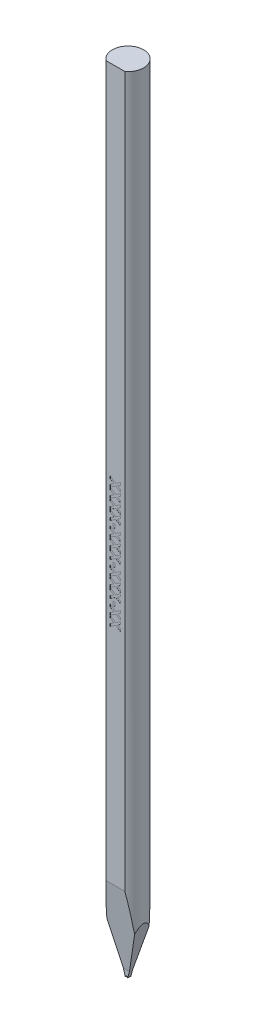
from build123d import *

# Parameters (mm, degrees)
SKETCH_TL_CUTTING_R       = 1.4986
TL_CUTTING_DEPTH          = 75.9968
SKETCH_TDF_GRINDING_W     = 3.0172
SKETCH_TDF_GRINDING_H     = 3.0172
TDF_GRINDING_DEPTH        = 77.026345527
SKETCH_ENGRAVING_W        = 0.166666667
SKETCH_ENGRAVING_H        = 0.371794872
ENGRAVING_DEPTH           = 0.005
VW_VR_GRINDING_DEPTH      = 1.5086
VW_VR_GRINDING_DEPTH_BACK = 1.5086
ISA_GRINDING_DEPTH        = 1.5086
ISA_GRINDING_DEPTH_BACK   = 1.5086
PRE_FRX_BRX_DEPTH         = 1.5086
PRE_FRX_BRX_DEPTH_BACK    = 1.5086
SKETCH_PRE_FRX_BRX_W      = 1.35874
SKETCH_PRE_FRX_BRX_H      = 0.6096
FR_EDM_R                  = 0.0381
BR_EDM_R                  = 0.0381
FA_BA_GRINDING_DEPTH      = 1.5086
FA_BA_GRINDING_DEPTH_BACK = 1.5086


with BuildPart() as part:
    # sketch_TL_cutting → TL_cutting (new body)
    with BuildSketch(Plane(origin=(0, 0, 0), x_dir=(1, 0, 0), z_dir=(0, 1, 0))):
        with Locations(Location((0, 0, 0), (0, 0, 270))):
            Circle(SKETCH_TL_CUTTING_R)
    extrude(amount=TL_CUTTING_DEPTH)

    # sketch_TDF_grinding → TDF_grinding (cut, through all)
    with BuildSketch(Plane(origin=(0, 0, 0), x_dir=(1, 0, 0), z_dir=(0, 1, 0))):
        with Locations((0, -2.71002)):
            Rectangle(SKETCH_TDF_GRINDING_W, SKETCH_TDF_GRINDING_H)
    extrude(amount=TDF_GRINDING_DEPTH, mode=Mode.SUBTRACT)

    # sketch_engraving → engraving (cut)
    with BuildSketch(Plane.XY.offset(1.20142)):
        Polygon((-0.5, 41.791829744), (0.029647436, 41.449081346), (0.5, 41.753368205), (0.5, 41.52860859), (0.203325321, 41.336701538), (0.5, 41.144794487), (0.5, 40.920034872), (0.029647436, 41.224321731), (-0.5, 40.881573333), (-0.5, 41.106332949), (-0.144030449, 41.336701538), (-0.5, 41.567070128), align=None)
        Polygon((-0.5, 40.868752821), (0.029647436, 40.526004423), (0.5, 40.830291282), (0.5, 40.605531667), (0.203325321, 40.413624615), (0.5, 40.221717564), (0.5, 39.996957949), (0.029647436, 40.301244808), (-0.5, 39.95849641), (-0.5, 40.183256026), (-0.144030449, 40.413624615), (-0.5, 40.643993205), align=None)
        Polygon((-0.5, 39.945675897), (0.029647436, 39.6029275), (0.5, 39.907214359), (0.5, 39.682454744), (0.203325321, 39.490547692), (0.5, 39.298640641), (0.5, 39.073881026), (0.029647436, 39.378167885), (-0.5, 39.035419487), (-0.5, 39.260179103), (-0.144030449, 39.490547692), (-0.5, 39.720916282), align=None)
        Polygon((-0.5, 39.022598974), (0.029647436, 38.679850577), (0.5, 38.984137436), (0.5, 38.759377821), (0.203325321, 38.567470769), (0.5, 38.375563718), (0.5, 38.150804103), (0.029647436, 38.455090962), (-0.5, 38.112342564), (-0.5, 38.337102179), (-0.144030449, 38.567470769), (-0.5, 38.797839359), align=None)
        with Locations((-0.147435898, 37.843111795)):
            Rectangle(SKETCH_ENGRAVING_W, SKETCH_ENGRAVING_H)
        Polygon((-0.5, 37.63798359), (0.029647436, 37.295235192), (0.5, 37.599522051), (0.5, 37.374762436), (0.203325321, 37.182855385), (0.5, 36.990948333), (0.5, 36.766188718), (0.029647436, 37.070475577), (-0.5, 36.727727179), (-0.5, 36.952486795), (-0.144030449, 37.182855385), (-0.5, 37.413223974), align=None)
        Polygon((-0.5, 36.714906667), (0.029647436, 36.372158269), (0.5, 36.676445128), (0.5, 36.451685513), (0.203325321, 36.259778462), (0.5, 36.06787141), (0.5, 35.843111795), (0.029647436, 36.147398654), (-0.5, 35.804650256), (-0.5, 36.029409872), (-0.144030449, 36.259778462), (-0.5, 36.490147051), align=None)
        Polygon((-0.5, 35.791829744), (0.029647436, 35.449081346), (0.5, 35.753368205), (0.5, 35.52860859), (0.203325321, 35.336701538), (0.5, 35.144794487), (0.5, 34.920034872), (0.029647436, 35.224321731), (-0.5, 34.881573333), (-0.5, 35.106332949), (-0.144030449, 35.336701538), (-0.5, 35.567070128), align=None)
        with Locations((-0.147435898, 34.612342564)):
            Rectangle(SKETCH_ENGRAVING_W, SKETCH_ENGRAVING_H)
        Polygon((-0.5, 34.407214359), (0.029647436, 34.064465962), (0.5, 34.368752821), (0.5, 34.143993205), (0.203325321, 33.952086154), (0.5, 33.760179103), (0.5, 33.535419487), (0.029647436, 33.839706346), (-0.5, 33.496957949), (-0.5, 33.721717564), (-0.144030449, 33.952086154), (-0.5, 34.182454744), align=None)
        Polygon((-0.5, 33.484137436), (0.029647436, 33.141389038), (0.5, 33.445675897), (0.5, 33.220916282), (0.203325321, 33.029009231), (0.5, 32.837102179), (0.5, 32.612342564), (0.029647436, 32.916629423), (-0.5, 32.573881026), (-0.5, 32.798640641), (-0.144030449, 33.029009231), (-0.5, 33.259377821), align=None)
        Polygon((-0.5, 32.561060513), (0.029647436, 32.218312115), (0.5, 32.522598974), (0.5, 32.297839359), (0.203325321, 32.105932308), (0.5, 31.914025256), (0.5, 31.689265641), (0.029647436, 31.9935525), (-0.5, 31.650804103), (-0.5, 31.875563718), (-0.144030449, 32.105932308), (-0.5, 32.336300897), align=None)
        with Locations((-0.147435898, 31.381573333)):
            Rectangle(SKETCH_ENGRAVING_W, SKETCH_ENGRAVING_H)
        Polygon((-0.5, 31.176445128), (0.029647436, 30.833696731), (0.5, 31.13798359), (0.5, 30.913223974), (0.203325321, 30.721316923), (0.5, 30.529409872), (0.5, 30.304650256), (0.029647436, 30.608937115), (-0.5, 30.266188718), (-0.5, 30.490948333), (-0.144030449, 30.721316923), (-0.5, 30.951685513), align=None)
        Polygon((-0.5, 30.253368205), (0.029647436, 29.910619808), (0.5, 30.214906667), (0.5, 29.990147051), (0.203325321, 29.79824), (0.5, 29.606332949), (0.5, 29.381573333), (0.029647436, 29.685860192), (-0.5, 29.343111795), (-0.5, 29.56787141), (-0.144030449, 29.79824), (-0.5, 30.02860859), align=None)
    extrude(amount=-ENGRAVING_DEPTH, mode=Mode.SUBTRACT)

    # sketch_VW_VR_grinding → VW_VR_grinding (cut, two sides: drawn at the far end of the back side and taken through both)
    with BuildSketch(Plane.XY.offset(-VW_VR_GRINDING_DEPTH_BACK)):
        with BuildLine():
            Line((-1.4936, -0.01), (-1.4936, 0.5946))
            ThreePointArc((-1.4936, 0.5946), (-1.495064466, 0.598135534), (-1.4986, 0.5996))
            Line((-1.4986, 0.5996), (-1.5086, 0.5996))
            Line((-1.5086, 0.5996), (-1.5086, -0.01))
            Line((-1.5086, -0.01), (-1.4936, -0.01))
        make_face()
        with BuildLine():
            Line((1.4936, -0.01), (1.4936, 0.5946))
            ThreePointArc((1.4936, 0.5946), (1.495064466, 0.598135534), (1.4986, 0.5996))
            Line((1.4986, 0.5996), (1.5086, 0.5996))
            Line((1.5086, 0.5996), (1.5086, -0.01))
            Line((1.5086, -0.01), (1.4936, -0.01))
        make_face()
    extrude(amount=VW_VR_GRINDING_DEPTH + VW_VR_GRINDING_DEPTH_BACK, mode=Mode.SUBTRACT)

    # sketch_ISA_grinding → ISA_grinding (cut, two sides: drawn at the far end of the back side and taken through both)
    with BuildSketch(Plane.XY.offset(-ISA_GRINDING_DEPTH_BACK)):
        Polygon((-0.12446, 0), (-1.5086, 5.165680805), (-1.5086, -0.01), (1.5086, -0.01), (1.5086, 5.165680805), (0.12446, 0), align=None)
    extrude(amount=ISA_GRINDING_DEPTH + ISA_GRINDING_DEPTH_BACK, mode=Mode.SUBTRACT)

    # sketch_pre_FRX_BRX → pre_FRX_BRX (cut, two sides: drawn at the far end of the back side and taken through both)
    with BuildSketch(Plane(origin=(0, 0, 0), x_dir=(0, 0, -1), z_dir=(1, 0, 0)).offset(-PRE_FRX_BRX_DEPTH_BACK)):
        with Locations((-0.82923, 0.2948)):
            Rectangle(SKETCH_PRE_FRX_BRX_W, SKETCH_PRE_FRX_BRX_H)
        with Locations((0.82923, 0.2948)):
            Rectangle(SKETCH_PRE_FRX_BRX_W, SKETCH_PRE_FRX_BRX_H)
    extrude(amount=PRE_FRX_BRX_DEPTH + PRE_FRX_BRX_DEPTH_BACK, mode=Mode.SUBTRACT)

    # V-Groove_EDM: sweep along a path in sketch_contour_V-Groove
    with BuildLine(Plane(origin=(0, 0, 0), x_dir=(0, 0, -1), z_dir=(1, 0, 0))) as v_groove_edm_path:
        Line((-1.20142, 0.07874), (0, 0.07874))
        Line((0, 0.07874), (1.4986, 0.07874))
    # sketch_section_V-Groove → V-Groove_EDM (sweep, cut)
    with BuildSketch(Plane.XY.offset(1.20142)):
        with BuildLine():
            Line((-0.619923416, -0.7874), (-0.021157771, 0.067725961))
            ThreePointArc((-0.021157771, 0.067725961), (0, 0.07874), (0.021157771, 0.067725961))
            Line((0.021157771, 0.067725961), (0.619923416, -0.7874))
            Line((0.619923416, -0.7874), (-0.619923416, -0.7874))
        make_face()
    sweep(path=v_groove_edm_path.line, mode=Mode.SUBTRACT)

    # FR_EDM
    fr_edm_edges = [part.edges().sort_by_distance(p)[0] for p in [
        (-0.044868886, 0.033862981, 0.14986),
        (0, 0.07874, 0.14986),
        (0.044868886, 0.033862981, 0.14986),
    ]]
    fillet(fr_edm_edges, radius=FR_EDM_R)

    # BR_EDM
    br_edm_edges = [part.edges().sort_by_distance(p)[0] for p in [
        (-0.044868886, 0.033862981, -0.14986),
        (0, 0.07874, -0.14986),
        (0.044868886, 0.033862981, -0.14986),
    ]]
    fillet(br_edm_edges, radius=BR_EDM_R)

    # sketch_FA_BA_grinding → FA_BA_grinding (cut, two sides: drawn at the far end of the back side and taken through both)
    with BuildSketch(Plane(origin=(0, 0, 0), x_dir=(0, 0, -1), z_dir=(1, 0, 0)).offset(-FA_BA_GRINDING_DEPTH_BACK)):
        Polygon((2.4986, 17.321753482), (2.4986, -0.1), (0.14986, -0.1), (0.14986, 0.6096), align=None)
        Polygon((-3.097568656, 21.583636919), (-0.14986, 0.6096), (-0.14986, -0.1), (-3.097568656, -0.1), align=None)
    extrude(amount=FA_BA_GRINDING_DEPTH + FA_BA_GRINDING_DEPTH_BACK, mode=Mode.SUBTRACT)


solid = part.part
